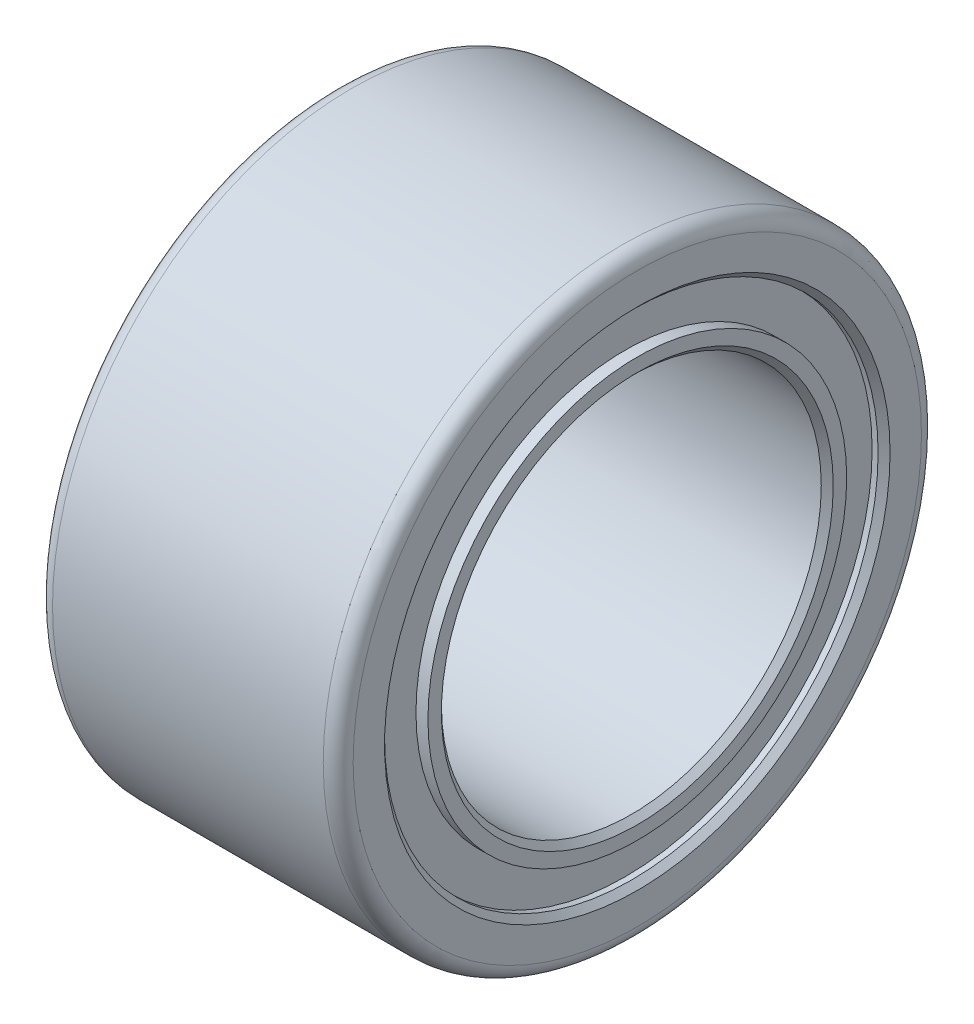
from build123d import *

# Parameters (mm, degrees)
SKETCH2_R           = 5
BOSS_EXTRUDE1_DEPTH = 2.4892
SKETCH3_R           = 3.175
CUT_EXTRUDE1_DEPTH  = 9.647801256
SKETCH4_R           = 4.125
SKETCH4_R_2         = 3.5
CUT_EXTRUDE2_DEPTH  = 0.2
CHAMFER1_SIZE       = 0.1
FILLET1_R           = 0.25


with BuildPart() as part:
    # Sketch2 → Boss-Extrude1 (new, symmetric)
    with BuildSketch(Plane(origin=(0, 0, 0), x_dir=(0, 0, -1), z_dir=(1, 0, 0))):
        Circle(SKETCH2_R)
    extrude(amount=BOSS_EXTRUDE1_DEPTH, both=True)

    # Sketch3 → Cut-Extrude1 (cut, through all)
    with BuildSketch(Plane(origin=(2.4892, 0, 0), x_dir=(0, 0, -1), z_dir=(1, 0, 0))):
        Circle(SKETCH3_R)
    extrude(amount=-CUT_EXTRUDE1_DEPTH, mode=Mode.SUBTRACT)

    # Sketch4 → Cut-Extrude2 (cut)
    with BuildSketch(Plane(origin=(2.4892, 0, 0), x_dir=(0, 0, -1), z_dir=(1, 0, 0))):
        Circle(SKETCH4_R)
        Circle(SKETCH4_R_2, mode=Mode.SUBTRACT)
    cut_extrude2 = extrude(amount=-CUT_EXTRUDE2_DEPTH, mode=Mode.SUBTRACT)

    # Mirror1: Cut-Extrude2 across plane
    add(cut_extrude2.mirror(Plane(origin=(0, 0, 0), x_dir=(0, 0, 1), z_dir=(1, 0, 0))), mode=Mode.SUBTRACT)

    # Chamfer1
    chamfer1_edges = [part.edges().sort_by_distance(p)[0] for p in [
        (2.4892, 0, 4.125),
        (-2.4892, 0, 5),
        (-2.4892, 0, 3.175),
        (2.4892, 0, 3.175),
    ]]
    chamfer(chamfer1_edges, length=CHAMFER1_SIZE)

    # Fillet1
    fillet1_edges = [part.edges().sort_by_distance(p)[0] for p in [
        (-2.3892, 0, 5),
        (2.4892, 0, 5),
    ]]
    fillet(fillet1_edges, radius=FILLET1_R)


solid = part.part
